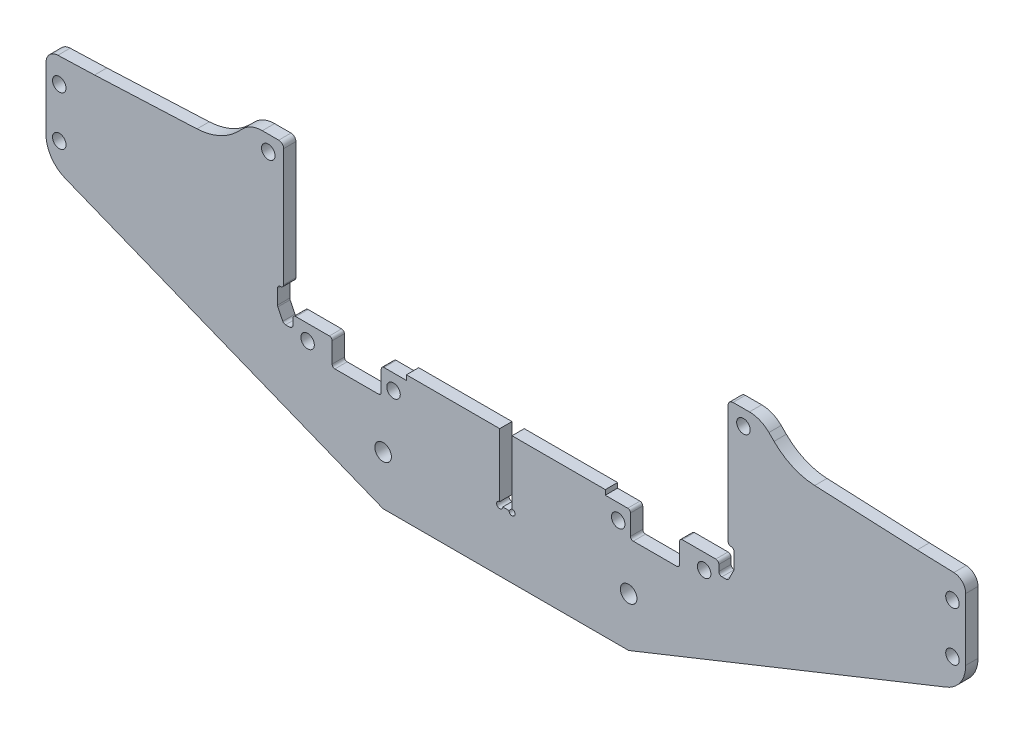
from build123d import *

# Parameters (mm, degrees)
SKETCH_1_R      = 1.1
SKETCH_1_R_2    = 1.35
EXTRUDE_1_DEPTH = 2


with BuildPart() as part:
    # 草图1 → 凸台-拉伸1 (new body)
    with BuildSketch(Plane.XY):
        with BuildLine():
            Line((36.2, 20.95), (36.2, 1.75))
            ThreePointArc((36.2, 1.75), (36.346446609, 1.396446609), (36.7, 1.25))
            ThreePointArc((36.7, 1.25), (37.053553391, 1.103553391), (37.2, 0.75))
            Line((37.2, 0.75), (37.2, -1.631966011))
            ThreePointArc((37.2, -1.631966011), (37.186624495, -1.746842472), (37.147213595, -1.855572809))
            Line((37.147213595, -1.855572809), (36.338196601, -3.473606798))
            ThreePointArc((36.338196601, -3.473606798), (36.153848562, -3.675325404), (35.890983006, -3.75))
            Line((35.890983006, -3.75), (35.2, -3.75))
            ThreePointArc((35.2, -3.75), (34.846446609, -3.603553391), (34.7, -3.25))
            Line((34.7, -3.25), (34.7, -2.25))
            ThreePointArc((34.7, -2.25), (34.553553391, -1.896446609), (34.2, -1.75))
            Line((34.2, -1.75), (28.75, -1.75))
            ThreePointArc((28.75, -1.75), (28.431801948, -1.881801948), (28.3, -2.2))
            Line((28.3, -2.2), (28.3, -5.5))
            ThreePointArc((28.3, -5.5), (28.168198052, -5.818198052), (27.85, -5.95))
            Line((27.85, -5.95), (20.75, -5.95))
            ThreePointArc((20.75, -5.95), (20.431801948, -5.818198052), (20.3, -5.5))
            Line((20.3, -5.5), (20.3, -2.2))
            ThreePointArc((20.3, -2.2), (20.168198052, -1.881801948), (19.85, -1.75))
            Line((19.85, -1.75), (16.2, -1.75))
            Line((16.2, -1.75), (16.2, -0.95))
            Line((16.2, -0.95), (1, -0.95))
            Line((1, -0.95), (1, -11.25))
            ThreePointArc((1, -11.25), (1.353553391, -12.103553391), (0.5, -11.75))
            Line((0.5, -11.75), (-0.5, -11.75))
            ThreePointArc((-0.5, -11.75), (-1.353553391, -12.103553391), (-1, -11.25))
            Line((-1, -11.25), (-1, -0.95))
            Line((-1, -0.95), (-16.2, -0.95))
            Line((-16.2, -0.95), (-16.2, -1.75))
            Line((-16.2, -1.75), (-19.85, -1.75))
            ThreePointArc((-19.85, -1.75), (-20.168198052, -1.881801948), (-20.3, -2.2))
            Line((-20.3, -2.2), (-20.3, -5.5))
            ThreePointArc((-20.3, -5.5), (-20.431801948, -5.818198052), (-20.75, -5.95))
            Line((-20.75, -5.95), (-27.85, -5.95))
            ThreePointArc((-27.85, -5.95), (-28.168198052, -5.818198052), (-28.3, -5.5))
            Line((-28.3, -5.5), (-28.3, -2.2))
            ThreePointArc((-28.3, -2.2), (-28.431801948, -1.881801948), (-28.75, -1.75))
            Line((-28.75, -1.75), (-34.2, -1.75))
            ThreePointArc((-34.2, -1.75), (-34.553553391, -1.896446609), (-34.7, -2.25))
            Line((-34.7, -2.25), (-34.7, -3.25))
            ThreePointArc((-34.7, -3.25), (-34.846446609, -3.603553391), (-35.2, -3.75))
            Line((-35.2, -3.75), (-35.890983006, -3.75))
            ThreePointArc((-35.890983006, -3.75), (-36.153848562, -3.675325404), (-36.338196601, -3.473606798))
            Line((-36.338196601, -3.473606798), (-37.147213595, -1.855572809))
            ThreePointArc((-37.147213595, -1.855572809), (-37.186624495, -1.746842472), (-37.2, -1.631966011))
            Line((-37.2, -1.631966011), (-37.2, 0.75))
            ThreePointArc((-37.2, 0.75), (-37.053553391, 1.103553391), (-36.7, 1.25))
            ThreePointArc((-36.7, 1.25), (-36.346446609, 1.396446609), (-36.2, 1.75))
            Line((-36.2, 1.75), (-36.2, 20.95))
            ThreePointArc((-36.2, 20.95), (-36.434314575, 21.515685425), (-37, 21.75))
            Line((-37, 21.75), (-39.671594525, 21.75))
            ThreePointArc((-39.671594525, 21.75), (-41.393669971, 21.407457896), (-42.85357504, 20.431980515))
            Line((-42.85357504, 20.431980515), (-43.685952604, 19.599602951))
            ThreePointArc((-43.685952604, 19.599602951), (-46.725975031, 17.519131379), (-50.31301428, 16.680532699))
            Line((-50.31301428, 16.680532699), (-67, 15.938888889))
            Line((-67, 15.938888889), (-72.978782406, 15.739596142))
            ThreePointArc((-72.978782406, 15.739596142), (-74.349730451, 15.13116321), (-74.912152745, 13.740706328))
            Line((-74.912152745, 13.740706328), (-74.912152745, 3.600025905))
            ThreePointArc((-74.912152745, 3.600025905), (-74.052488898, 0.796881859), (-71.769106127, -1.042357549))
            Line((-71.769106127, -1.042357549), (-20, -21.75))
            Line((-20, -21.75), (20, -21.75))
            Line((20, -21.75), (71.769106127, -1.042357549))
            ThreePointArc((71.769106127, -1.042357549), (74.052488898, 0.796881859), (74.912152745, 3.600025905))
            Line((74.912152745, 3.600025905), (74.912152745, 13.740706328))
            ThreePointArc((74.912152745, 13.740706328), (74.349730451, 15.13116321), (72.978782406, 15.739596142))
            Line((72.978782406, 15.739596142), (67, 15.938888889))
            Line((67, 15.938888889), (50.31301428, 16.680532699))
            ThreePointArc((50.31301428, 16.680532699), (46.725975031, 17.519131379), (43.685952604, 19.599602951))
            Line((43.685952604, 19.599602951), (42.85357504, 20.431980515))
            ThreePointArc((42.85357504, 20.431980515), (41.393669971, 21.407457896), (39.671594525, 21.75))
            Line((39.671594525, 21.75), (37, 21.75))
            ThreePointArc((37, 21.75), (36.434314575, 21.515685425), (36.2, 20.95))
        make_face()
        with Locations((72.75, 3.75716439)):
            Circle(SKETCH_1_R, mode=Mode.SUBTRACT)
        with Locations((72.75, 11.75716439)):
            Circle(SKETCH_1_R, mode=Mode.SUBTRACT)
        with Locations((38.7, 19.25)):
            Circle(SKETCH_1_R, mode=Mode.SUBTRACT)
        with Locations((32.3, -4.25)):
            Circle(SKETCH_1_R, mode=Mode.SUBTRACT)
        with Locations((18.3, -4.25)):
            Circle(SKETCH_1_R, mode=Mode.SUBTRACT)
        with Locations((20, -13.75)):
            Circle(SKETCH_1_R_2, mode=Mode.SUBTRACT)
        with Locations((-18.3, -4.25)):
            Circle(SKETCH_1_R, mode=Mode.SUBTRACT)
        with Locations((-32.3, -4.25)):
            Circle(SKETCH_1_R, mode=Mode.SUBTRACT)
        with Locations((-20, -13.75)):
            Circle(SKETCH_1_R_2, mode=Mode.SUBTRACT)
        with Locations((-38.7, 19.25)):
            Circle(SKETCH_1_R, mode=Mode.SUBTRACT)
        with Locations((-72.75, 3.75716439)):
            Circle(SKETCH_1_R, mode=Mode.SUBTRACT)
        with Locations((-72.75, 11.75716439)):
            Circle(SKETCH_1_R, mode=Mode.SUBTRACT)
    extrude(amount=EXTRUDE_1_DEPTH)


solid = part.part
